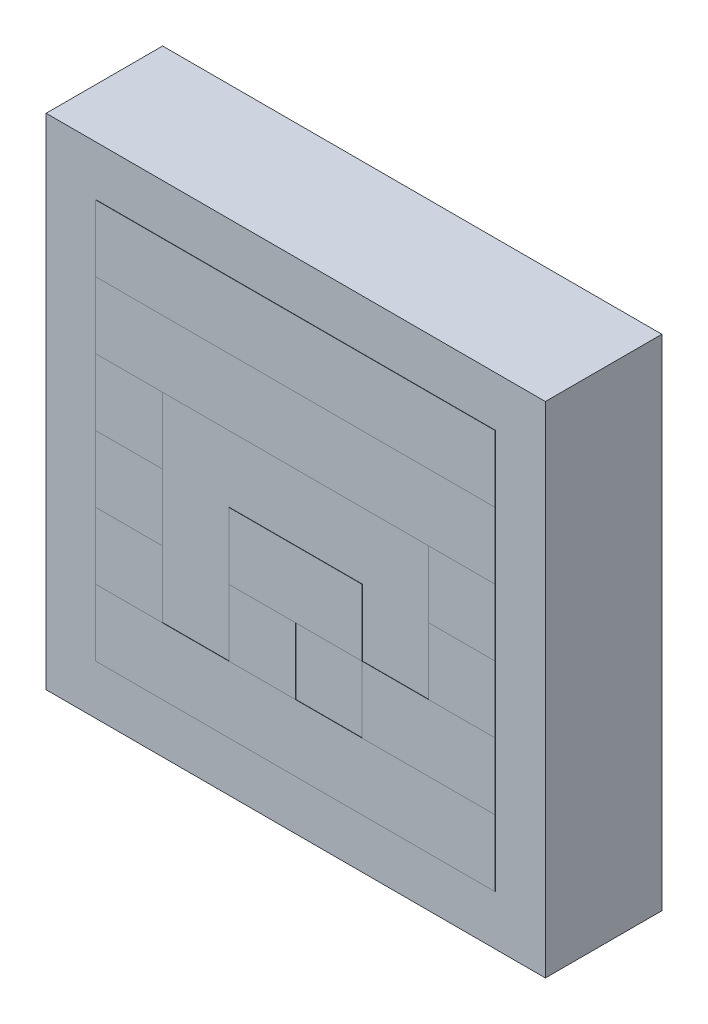
from build123d import *

# Parameters (mm, degrees)
SKETCH_1_W                     = 60
SKETCH_1_H                     = 60
COPLANAR_SUPPORT60X60X14_DEPTH = 14
SKETCH_2_W                     = 48
SKETCH_2_H                     = 8
ID1_ROW0_DEPTH                 = 0.04
SKETCH_3_W                     = 48
SKETCH_3_H                     = 8
ID1_ROW1_DEPTH                 = 0.04
SKETCH_4_W                     = 8
SKETCH_4_H                     = 8
ID1_ROW2_DEPTH                 = 0.04
ID1_ROW2_2_DEPTH               = 0.04
SKETCH_5_W                     = 8
SKETCH_5_H                     = 8
ID1_ROW3_DEPTH                 = 0.04
SKETCH_5_W_2                   = 16
ID1_ROW3_2_DEPTH               = 0.04
ID1_ROW3_3_DEPTH               = 0.04
SKETCH_6_W                     = 8
SKETCH_6_H                     = 8
ID1_ROW4_DEPTH                 = 0.04
ID1_ROW4_2_DEPTH               = 0.04
SKETCH_6_W_2                   = 16
ID1_ROW4_3_DEPTH               = 0.04
SKETCH_7_W                     = 48
SKETCH_7_H                     = 8
ID1_ROW5_DEPTH                 = 0.04


with BuildPart() as part:
    # 草图1 → Coplanar_support60x60x14 (new body)
    with BuildSketch(Plane.XY):
        Rectangle(SKETCH_1_W, SKETCH_1_H)
    extrude(amount=-COPLANAR_SUPPORT60X60X14_DEPTH)


with BuildPart() as body_2:
    # 草图2 → ID1_row0 (new body)
    with BuildSketch(Plane.XY):
        with Locations((0, 20)):
            Rectangle(SKETCH_2_W, SKETCH_2_H)
    extrude(amount=ID1_ROW0_DEPTH)


with BuildPart() as body_3:
    # 草图3 → ID1_row1 (new body)
    with BuildSketch(Plane.XY):
        with Locations((0, 12)):
            Rectangle(SKETCH_3_W, SKETCH_3_H)
    extrude(amount=ID1_ROW1_DEPTH)


with BuildPart() as body_4:
    # 草图4 → ID1_row2 (new body)
    with BuildSketch(Plane.XY):
        with Locations((-20, 4)):
            Rectangle(SKETCH_4_W, SKETCH_4_H)
    extrude(amount=ID1_ROW2_DEPTH)


with BuildPart() as body_5:
    # 草图4 → ID1_row2 2 (new body)
    with BuildSketch(Plane.XY):
        with Locations((20, 4)):
            Rectangle(SKETCH_4_W, SKETCH_4_H)
    extrude(amount=ID1_ROW2_2_DEPTH)


with BuildPart() as body_6:
    # 草图5 → ID1_row3 (new body)
    with BuildSketch(Plane.XY):
        with Locations((-20, -4)):
            Rectangle(SKETCH_5_W, SKETCH_5_H)
    extrude(amount=ID1_ROW3_DEPTH)


with BuildPart() as body_7:
    # 草图5 → ID1_row3 2 (new body)
    with BuildSketch(Plane.XY):
        with Locations((0, -4)):
            Rectangle(SKETCH_5_W_2, SKETCH_5_H)
    extrude(amount=ID1_ROW3_2_DEPTH)


with BuildPart() as body_8:
    # 草图5 → ID1_row3 3 (new body)
    with BuildSketch(Plane.XY):
        with Locations((20, -4)):
            Rectangle(SKETCH_5_W, SKETCH_5_H)
    extrude(amount=ID1_ROW3_3_DEPTH)


with BuildPart() as body_9:
    # 草图6 → ID1_row4 (new body)
    with BuildSketch(Plane.XY):
        with Locations((-20, -12)):
            Rectangle(SKETCH_6_W, SKETCH_6_H)
    extrude(amount=ID1_ROW4_DEPTH)


with BuildPart() as body_10:
    # 草图6 → ID1_row4 2 (new body)
    with BuildSketch(Plane.XY):
        with Locations((-4, -12)):
            Rectangle(SKETCH_6_W, SKETCH_6_H)
    extrude(amount=ID1_ROW4_2_DEPTH)


with BuildPart() as body_11:
    # 草图6 → ID1_row4 3 (new body)
    with BuildSketch(Plane.XY):
        with Locations((16, -12)):
            Rectangle(SKETCH_6_W_2, SKETCH_6_H)
    extrude(amount=ID1_ROW4_3_DEPTH)


with BuildPart() as body_12:
    # 草图7 → ID1_row5 (new body)
    with BuildSketch(Plane.XY):
        with Locations((0, -20)):
            Rectangle(SKETCH_7_W, SKETCH_7_H)
    extrude(amount=ID1_ROW5_DEPTH)


solid = Compound([part.part, body_2.part, body_3.part, body_4.part, body_5.part, body_6.part, body_7.part, body_8.part, body_9.part, body_10.part, body_11.part, body_12.part])
